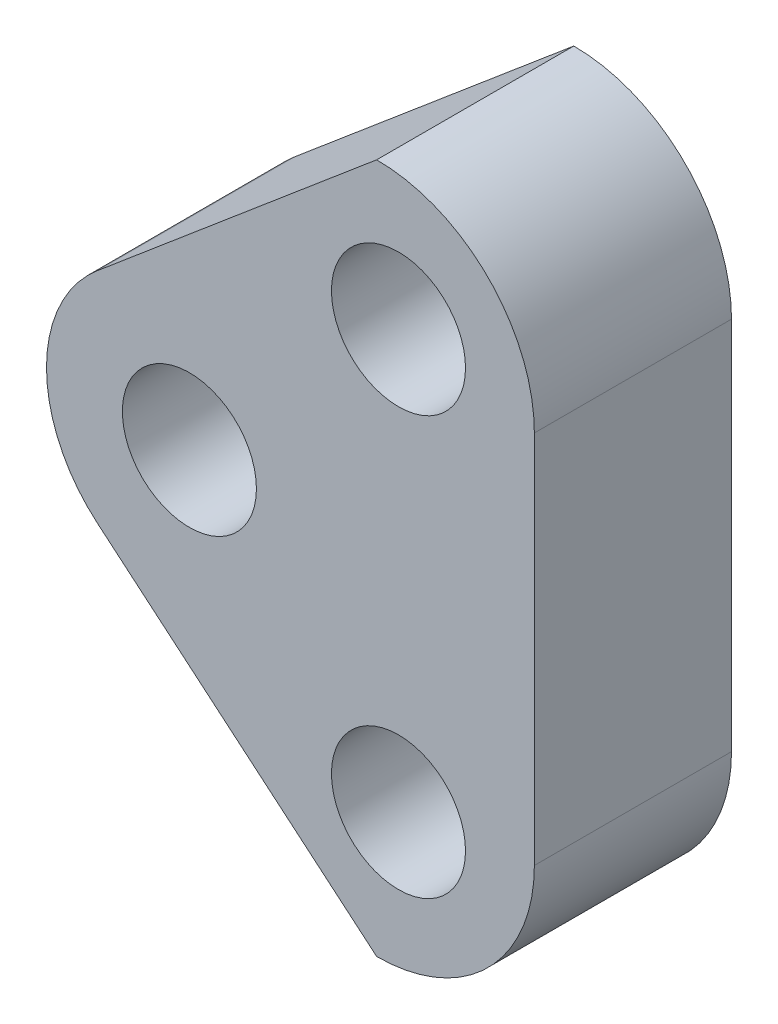
from build123d import *

# Parameters (mm, degrees)
SKETCH_1_R          = 3.4
EXTRUDE_1_DEPTH     = 11
SKETCH_2_R          = 3.4
EXTRUDE_2_DEPTH     = 3
SKETCH_3_R          = 3.4
CUT_EXTRUDE_1_DEPTH = 28.083205128
CUT_EXTRUDE_START   = -5
SKETCH_4_R          = 6
SKETCH_4_R_2        = 3.4
CUT_EXTRUDE_2_DEPTH = 5
CUT_EXTRUDE_3_DEPTH = 28.083205128
CUT_EXTRUDE_5_DEPTH = 28.083205128
SKETCH_8_R          = 3.4
EXTRUDE_3_DEPTH     = 1
CUT_EXTRUDE_START_2 = -1
CUT_EXTRUDE_6_DEPTH = 1
CUT_EXTRUDE_7_DEPTH = 1
CUT_EXTRUDE_START_3 = -10
CUT_EXTRUDE_8_DEPTH = 10
EXTRUDE_START       = -4
SKETCH_12_R         = 6
SKETCH_12_R_2       = 3.25
EXTRUDE_5_DEPTH     = 4


with BuildPart() as part:
    # 草图1 → 凸台-拉伸1 (new body)
    with BuildSketch(Plane.XY):
        with BuildLine():
            Line((-9.5, -17.5), (9.5, -17.5))
            ThreePointArc((9.5, -17.5), (15.156854249, -15.156854249), (17.5, -9.5))
            Line((17.5, -9.5), (17.5, 9.5))
            ThreePointArc((17.5, 9.5), (15.156854249, 15.156854249), (9.5, 17.5))
            Line((9.5, 17.5), (-9.5, 17.5))
            ThreePointArc((-9.5, 17.5), (-15.156854249, 15.156854249), (-17.5, 9.5))
            Line((-17.5, 9.5), (-17.5, -9.5))
            ThreePointArc((-17.5, -9.5), (-15.156854249, -15.156854249), (-9.5, -17.5))
        make_face()
        with Locations((10.606601718, 10.606601718)):
            Circle(SKETCH_1_R, mode=Mode.SUBTRACT)
        with Locations((10.606601718, -10.606601718)):
            Circle(SKETCH_1_R, mode=Mode.SUBTRACT)
        with Locations((-10.606601718, -10.606601718)):
            Circle(SKETCH_1_R, mode=Mode.SUBTRACT)
        with Locations((-10.606601718, 10.606601718)):
            Circle(SKETCH_1_R, mode=Mode.SUBTRACT)
    extrude(amount=EXTRUDE_1_DEPTH)

    # 草图2 → 凸台-拉伸2 (add)
    with BuildSketch(Plane(origin=(0, 0, 0), x_dir=(-1, 0, 0), z_dir=(0, 0, -1))):
        with Locations((10.606601718, -10.606601718)):
            Circle(SKETCH_2_R)
        with Locations((-10.606601718, -10.606601718)):
            Circle(SKETCH_2_R)
        with Locations((10.606601718, 10.606601718)):
            Circle(SKETCH_2_R)
        with Locations((-10.606601718, 10.606601718)):
            Circle(SKETCH_2_R)
    extrude(amount=-EXTRUDE_2_DEPTH)

    # 草图3 → 切除-拉伸1 (cut, through all)
    with BuildSketch(Plane.XY.offset(11)):
        Circle(SKETCH_3_R)
    extrude(amount=-CUT_EXTRUDE_1_DEPTH, mode=Mode.SUBTRACT)

    # 草图4 → 切除-拉伸2 (cut)
    with BuildSketch(Plane(origin=(0, 0, 0), x_dir=(-1, 0, 0), z_dir=(0, 0, -1)).offset(CUT_EXTRUDE_START)):
        Circle(SKETCH_4_R)
        with Locations(Location((0, 0, 0), (0, 0, 180))):
            Circle(SKETCH_4_R_2, mode=Mode.SUBTRACT)
    extrude(amount=CUT_EXTRUDE_2_DEPTH, mode=Mode.SUBTRACT)

    # 草图6 → 切除-拉伸3 (cut, through all)
    with BuildSketch(Plane(origin=(0, 0, 0), x_dir=(-1, 0, 0), z_dir=(0, 0, -1))):
        with BuildLine():
            Line((9.5, 17.5), (0, 17.5))
            Line((0, 17.5), (17.5, 0))
            Line((17.5, 0), (17.5, 9.5))
            ThreePointArc((17.5, 9.5), (15.156854249, 15.156854249), (9.5, 17.5))
        make_face()
        with BuildLine():
            Line((17.5, -9.5), (17.5, 0))
            Line((17.5, 0), (0, -17.5))
            Line((0, -17.5), (9.5, -17.5))
            ThreePointArc((9.5, -17.5), (15.156854249, -15.156854249), (17.5, -9.5))
        make_face()
    extrude(amount=-CUT_EXTRUDE_3_DEPTH, mode=Mode.SUBTRACT)

    # 草图7 → 切除-拉伸5 (cut, through all)
    with BuildSketch(Plane.XY.offset(11)):
        with BuildLine():
            Line((-7.222574041, -10.277425959), (0, -17.5))
            ThreePointArc((0, -17.5), (-7.248737342, 0), (0, 17.5))
            Line((0, 17.5), (-7.222574041, 10.277425959))
            ThreePointArc((-7.222574041, 10.277425959), (-8.202438662, 8.202438662), (-10.277425959, 7.222574041))
            Line((-10.277425959, 7.222574041), (-17.5, 0))
            Line((-17.5, 0), (-10.277425959, -7.222574041))
            ThreePointArc((-10.277425959, -7.222574041), (-8.202438662, -8.202438662), (-7.222574041, -10.277425959))
        make_face()
        with BuildLine():
            Line((-10.277425959, -7.222574041), (-7.222574041, -10.277425959))
            ThreePointArc((-7.222574041, -10.277425959), (-8.202438662, -8.202438662), (-10.277425959, -7.222574041))
        make_face()
        with BuildLine():
            ThreePointArc((-10.277425959, 7.222574041), (-8.202438662, 8.202438662), (-7.222574041, 10.277425959))
            Line((-7.222574041, 10.277425959), (-10.277425959, 7.222574041))
        make_face()
    extrude(amount=-CUT_EXTRUDE_5_DEPTH, mode=Mode.SUBTRACT)

    # 草图8 → 凸台-拉伸3 (add)
    with BuildSketch(Plane.XY.offset(11)):
        with BuildLine():
            Line((9.5, 17.5), (0, 17.5))
            ThreePointArc((0, 17.5), (-7.248737342, 0), (0, -17.5))
            Line((0, -17.5), (9.5, -17.5))
            ThreePointArc((9.5, -17.5), (15.156854249, -15.156854249), (17.5, -9.5))
            Line((17.5, -9.5), (17.5, 9.5))
            ThreePointArc((17.5, 9.5), (15.156854249, 15.156854249), (9.5, 17.5))
        make_face()
        Circle(SKETCH_8_R, mode=Mode.SUBTRACT)
        with Locations(Location((10.606601718, 10.606601718, 0), (0, 0, 180))):
            Circle(SKETCH_8_R, mode=Mode.SUBTRACT)
        with Locations(Location((10.606601718, -10.606601718, 0), (0, 0, 180))):
            Circle(SKETCH_8_R, mode=Mode.SUBTRACT)
    extrude(amount=EXTRUDE_3_DEPTH)

    # 草图9 → 切除-拉伸6 (cut)
    with BuildSketch(Plane.XY.offset(12).offset(CUT_EXTRUDE_START_2)):
        with BuildLine():
            Line((9.5, 17.5), (0, 17.5))
            ThreePointArc((0, 17.5), (-7.248737342, 0), (0, -17.5))
            Line((0, -17.5), (9.5, -17.5))
            ThreePointArc((9.5, -17.5), (15.156854249, -15.156854249), (17.5, -9.5))
            Line((17.5, -9.5), (17.5, 9.5))
            ThreePointArc((17.5, 9.5), (15.156854249, 15.156854249), (9.5, 17.5))
        make_face()
    extrude(amount=CUT_EXTRUDE_6_DEPTH, mode=Mode.SUBTRACT)

    # 草图10 → 切除-拉伸7 (cut)
    with BuildSketch(Plane(origin=(0, 0, 0), x_dir=(-1, 0, 0), z_dir=(0, 0, -1))):
        with BuildLine():
            Line((0, 17.5), (-9.5, 17.5))
            ThreePointArc((-9.5, 17.5), (-15.156854249, 15.156854249), (-17.5, 9.5))
            Line((-17.5, 9.5), (-17.5, -9.5))
            ThreePointArc((-17.5, -9.5), (-15.156854249, -15.156854249), (-9.5, -17.5))
            Line((-9.5, -17.5), (0, -17.5))
            ThreePointArc((0, -17.5), (7.248737342, 0), (0, 17.5))
        make_face()
    extrude(amount=-CUT_EXTRUDE_7_DEPTH, mode=Mode.SUBTRACT)

    # 草图11 → 切除-拉伸8 (cut)
    with BuildSketch(Plane(origin=(0, 0, 1), x_dir=(-1, 0, 0), z_dir=(0, 0, -1)).offset(CUT_EXTRUDE_START_3)):
        with BuildLine():
            Line((0, 17.5), (-9.5, 17.5))
            Line((-9.5, 17.5), (4.674526852, 5.540125608))
            ThreePointArc((4.674526852, 5.540125608), (6.573758833, 3.054486512), (7.248737342, 0))
            ThreePointArc((7.248737342, 0), (5.364851885, 9.470931753), (0, 17.5))
        make_face()
        with BuildLine():
            ThreePointArc((0, -17.5), (5.364851885, -9.470931753), (7.248737342, 0))
            ThreePointArc((7.248737342, 0), (6.573758833, -3.054486512), (4.674526852, -5.540125608))
            Line((4.674526852, -5.540125608), (-9.5, -17.5))
            Line((-9.5, -17.5), (0, -17.5))
        make_face()
    extrude(amount=CUT_EXTRUDE_8_DEPTH, mode=Mode.SUBTRACT)

    # 草图12 → 凸台-拉伸5 (add)
    with BuildSketch(Plane(origin=(0, 0, 1), x_dir=(-1, 0, 0), z_dir=(0, 0, -1)).offset(EXTRUDE_START)):
        Circle(SKETCH_12_R)
        Circle(SKETCH_12_R_2, mode=Mode.SUBTRACT)
    extrude(amount=EXTRUDE_5_DEPTH)


solid = part.part
